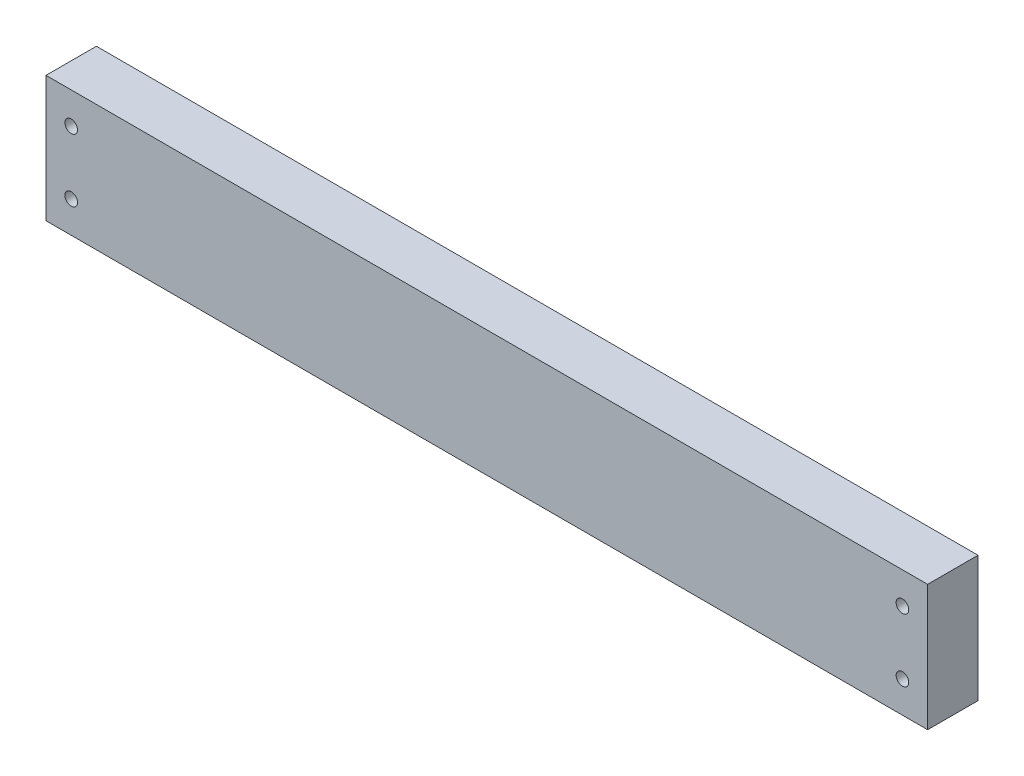
from build123d import *

# Parameters (mm, degrees)
SKIZZE1_W                       = 20
SKIZZE1_H                       = 50
AUFSATZ_LINEAR_AUSTRAGEN1_DEPTH = 350
SKIZZE2_R                       = 2.5
SCHNITT_LINEAR_AUSTRAGEN1_DEPTH = 352.461235416


with BuildPart() as part:
    # Skizze1 → Aufsatz-Linear austragen1 (new body)
    with BuildSketch(Plane(origin=(0, 0, 0), x_dir=(0, 0, -1), z_dir=(1, 0, 0))):
        Rectangle(SKIZZE1_W, SKIZZE1_H)
    extrude(amount=AUFSATZ_LINEAR_AUSTRAGEN1_DEPTH)

    # Skizze2 → Schnitt-Linear austragen1 (cut, through all)
    with BuildSketch(Plane.XY.offset(10)):
        with Locations((10, -12.5)):
            Circle(SKIZZE2_R)
        with Locations((10, 12.5)):
            Circle(SKIZZE2_R)
        with Locations((340, -12.5)):
            Circle(SKIZZE2_R)
        with Locations((340, 12.5)):
            Circle(SKIZZE2_R)
    extrude(amount=-SCHNITT_LINEAR_AUSTRAGEN1_DEPTH, mode=Mode.SUBTRACT)


solid = part.part
